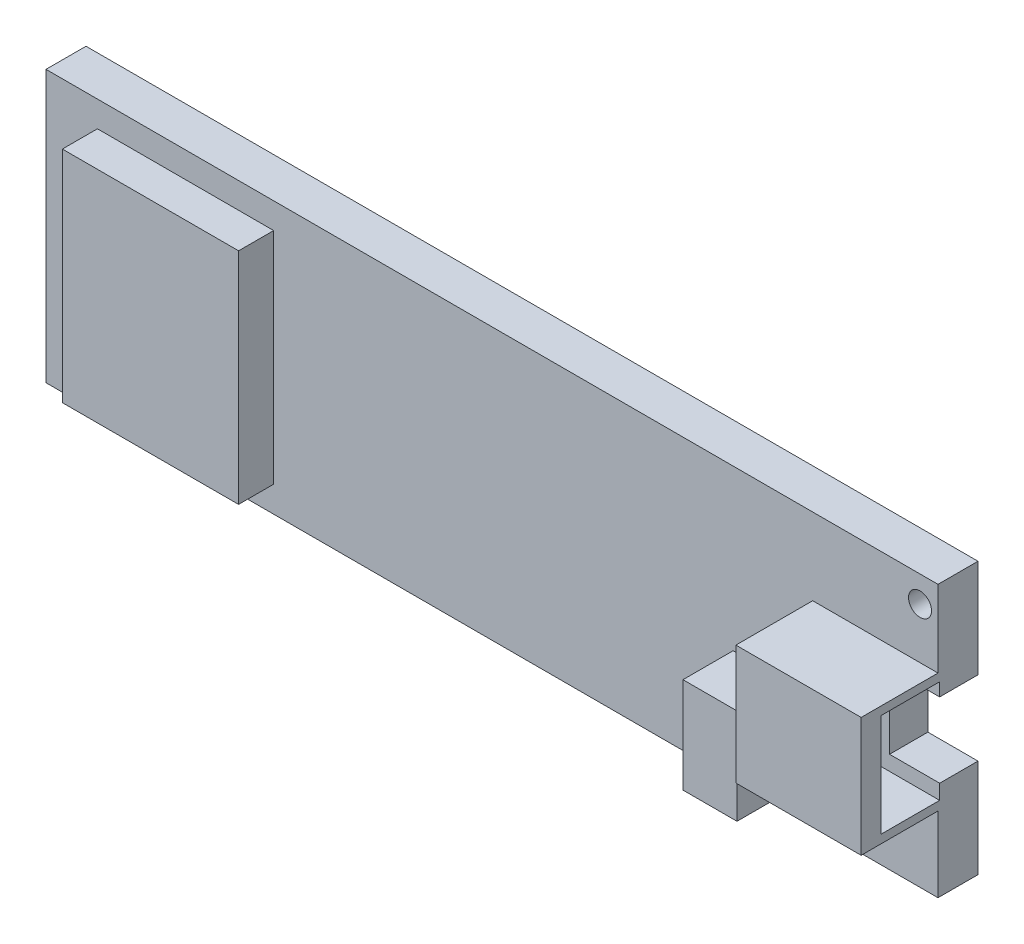
from build123d import *

# Parameters (mm, degrees)
SKETCH1_W           = 106.8
SKETCH1_H           = 32.5
BOSS_EXTRUDE1_DEPTH = 4.79
SKETCH2_W           = 21.1
SKETCH2_H           = 26.3
BOSS_EXTRUDE2_DEPTH = 4.2
SKETCH3_W           = 15
SKETCH3_H           = 14.3
BOSS_EXTRUDE3_DEPTH = 9.2
SKETCH4_W           = 6.47
SKETCH4_H           = 11.45
BOSS_EXTRUDE4_DEPTH = 6
SKETCH5_R           = 1.375
CUT_EXTRUDE1_DEPTH  = 57.570862641
SKETCH6_W           = 7
SKETCH6_H           = 12.3
CUT_EXTRUDE2_DEPTH  = 12
SKETCH7_W           = 4.917083014
SKETCH7_H           = 8.943215518
CUT_EXTRUDE3_DEPTH  = 6


with BuildPart() as part:
    # Sketch1 → Boss-Extrude1 (new body)
    with BuildSketch(Plane.XY):
        Rectangle(SKETCH1_W, SKETCH1_H)
    extrude(amount=BOSS_EXTRUDE1_DEPTH)

    # Sketch2 → Boss-Extrude2 (add)
    with BuildSketch(Plane.XY.offset(4.79)):
        with Locations((-36.69, 0.014279692)):
            Rectangle(SKETCH2_W, SKETCH2_H)
    extrude(amount=BOSS_EXTRUDE2_DEPTH)

    # Sketch3 → Boss-Extrude3 (add)
    with BuildSketch(Plane.XY.offset(4.79)):
        with Locations((45.9, -0.1)):
            Rectangle(SKETCH3_W, SKETCH3_H)
    extrude(amount=BOSS_EXTRUDE3_DEPTH)

    # Sketch4 → Boss-Extrude4 (add)
    with BuildSketch(Plane.XY.offset(4.79)):
        with Locations((32.1, -8.63)):
            Rectangle(SKETCH4_W, SKETCH4_H)
    extrude(amount=BOSS_EXTRUDE4_DEPTH)

    # Sketch5 → Cut-Extrude1 (cut, through all)
    with BuildSketch(Plane.XY.offset(4.79)):
        with Locations((51.25, 13.12)):
            Circle(SKETCH5_R)
    extrude(amount=-CUT_EXTRUDE1_DEPTH, mode=Mode.SUBTRACT)

    # Sketch6 → Cut-Extrude2 (cut)
    with BuildSketch(Plane(origin=(53.4, 0, 0), x_dir=(0, 0, -1), z_dir=(1, 0, 0))):
        with Locations((-8.09, -0.1)):
            Rectangle(SKETCH6_W, SKETCH6_H)
    extrude(amount=-CUT_EXTRUDE2_DEPTH, mode=Mode.SUBTRACT)

    # Sketch7 → Cut-Extrude3 (cut)
    with BuildSketch(Plane(origin=(53.4, 0, 0), x_dir=(0, 0, -1), z_dir=(1, 0, 0))):
        with Locations((-2.131458493, 0)):
            Rectangle(SKETCH7_W, SKETCH7_H)
    extrude(amount=-CUT_EXTRUDE3_DEPTH, mode=Mode.SUBTRACT)


solid = part.part
